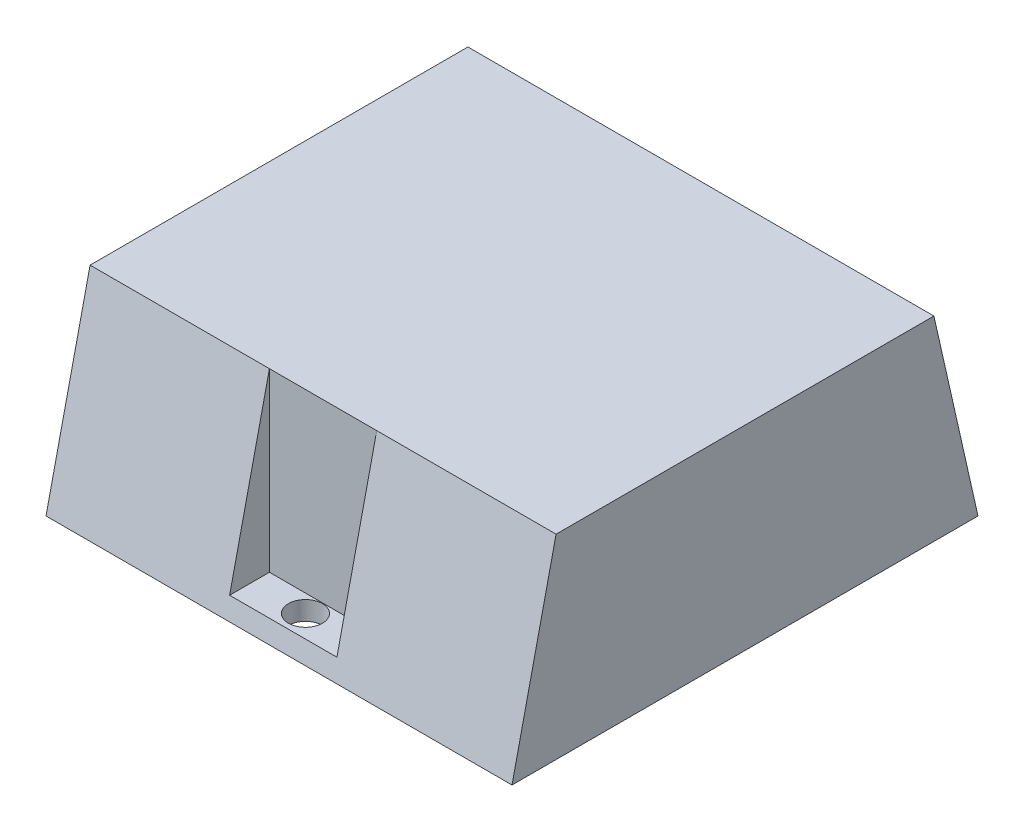
from build123d import *

# Parameters (mm, degrees)
SKETCH_1_W          = 74
SKETCH_1_H          = 74
EXTRUDE_1_DEPTH     = 31
SKETCH_2_OUTSIDE_W  = 97.83
SKETCH_2_OUTSIDE_H  = 54.83
CUT_EXTRUDE_1_DEPTH = 89.351570444
SKETCH_3_W          = 31.549660128
SKETCH_3_H          = 15.349381196
EXTRUDE_2_DEPTH     = 3
CUT_EXTRUDE_2_DEPTH = 28
SKETCH_6_R          = 2.7
CUT_EXTRUDE_4_DEPTH = 28


with BuildPart() as part:
    # 草图1 → 凸台-拉伸1 (new body)
    with BuildSketch(Plane(origin=(0, 0, 0), x_dir=(1, 0, 0), z_dir=(0, 1, 0))):
        Rectangle(SKETCH_1_W, SKETCH_1_H)
    extrude(amount=EXTRUDE_1_DEPTH)

    # 草图2 outside → 切除-拉伸1 (cut, through all)
    with BuildSketch(Plane.ZY.offset(37)):
        with Locations((0, 15.5)):
            Rectangle(SKETCH_2_OUTSIDE_W, SKETCH_2_OUTSIDE_H)
        Polygon((30, 31), (-30, 31), (-37, 0), (37, 0), align=None, mode=Mode.SUBTRACT)
    extrude(amount=-CUT_EXTRUDE_1_DEPTH, mode=Mode.SUBTRACT)

    # 草图3 → 凸台-拉伸2 (add)
    with BuildSketch(Plane.ZY.offset(37)):
        with Locations((0, 7.674690598)):
            Rectangle(SKETCH_3_W, SKETCH_3_H)
    extrude(amount=EXTRUDE_2_DEPTH)

    # 草图4 → 切除-拉伸2 (cut)
    with BuildSketch(Plane(origin=(0, 31, 0), x_dir=(1, 0, 0), z_dir=(0, 1, 0))):
        Polygon((8.519431151, 37), (-8.519431151, 37), (0, 33.5), align=None)
        Polygon((-8.519431151, 37), (-8.519431151, 30), (0, 33.5), align=None)
        Polygon((0, 33.5), (8.519431151, 30), (8.519431151, 37), align=None)
        Polygon((0, 33.5), (-8.519431151, 30), (8.519431151, 30), align=None)
        Polygon((-8.519431151, -30), (-8.519431151, -37), (0, -33.5), align=None)
        Polygon((0, -33.5), (-8.519431151, -37), (8.519431151, -37), align=None)
        Polygon((0, -33.5), (8.519431151, -37), (8.519431151, -30), align=None)
        Polygon((8.519431151, -30), (-8.519431151, -30), (0, -33.5), align=None)
    extrude(amount=-CUT_EXTRUDE_2_DEPTH, mode=Mode.SUBTRACT)

    # 草图6 → 切除-拉伸4 (cut)
    with BuildSketch(Plane(origin=(0, 3, 0), x_dir=(1, 0, 0), z_dir=(0, 1, 0))):
        with Locations(Location((0, -32.8, 0), (0, 0, 270))):
            Circle(SKETCH_6_R)
        with Locations(Location((0, 32.8, 0), (0, 0, 270))):
            Circle(SKETCH_6_R)
    extrude(amount=-CUT_EXTRUDE_4_DEPTH, mode=Mode.SUBTRACT)


solid = part.part
